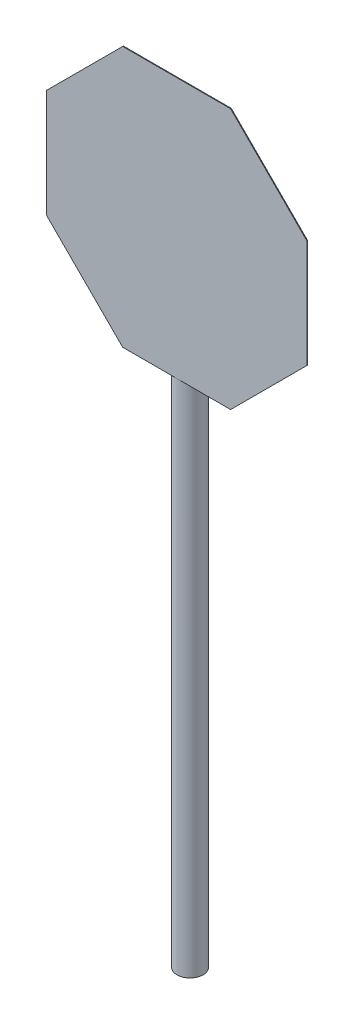
from build123d import *

# Parameters (mm, degrees)
SKETCH3_R           = 38.1
BOSS_EXTRUDE1_DEPTH = 2133.6
BOSS_EXTRUDE2_START = 38.1
BOSS_EXTRUDE2_DEPTH = 1.016


with BuildPart() as part:
    # Sketch3 → Boss-Extrude1 (new body)
    with BuildSketch(Plane(origin=(0, 0, 0), x_dir=(1, 0, 0), z_dir=(0, 1, 0))):
        with Locations(Location((0, 0, 0), (0, 0, 270))):
            Circle(SKETCH3_R)
    extrude(amount=BOSS_EXTRUDE1_DEPTH)

    # Sketch5 → Boss-Extrude2 (add, symmetric)
    with BuildSketch(Plane.XY.offset(BOSS_EXTRUDE2_START)):
        Polygon((-381, 1734.484632736), (-157.815367264, 1511.3), (157.815367264, 1511.3), (381, 1734.484632736), (381, 2050.115367264), (157.815367264, 2273.3), (-157.815367264, 2273.3), (-381, 2050.115367264), align=None)
    extrude(amount=BOSS_EXTRUDE2_DEPTH, both=True)


solid = part.part
